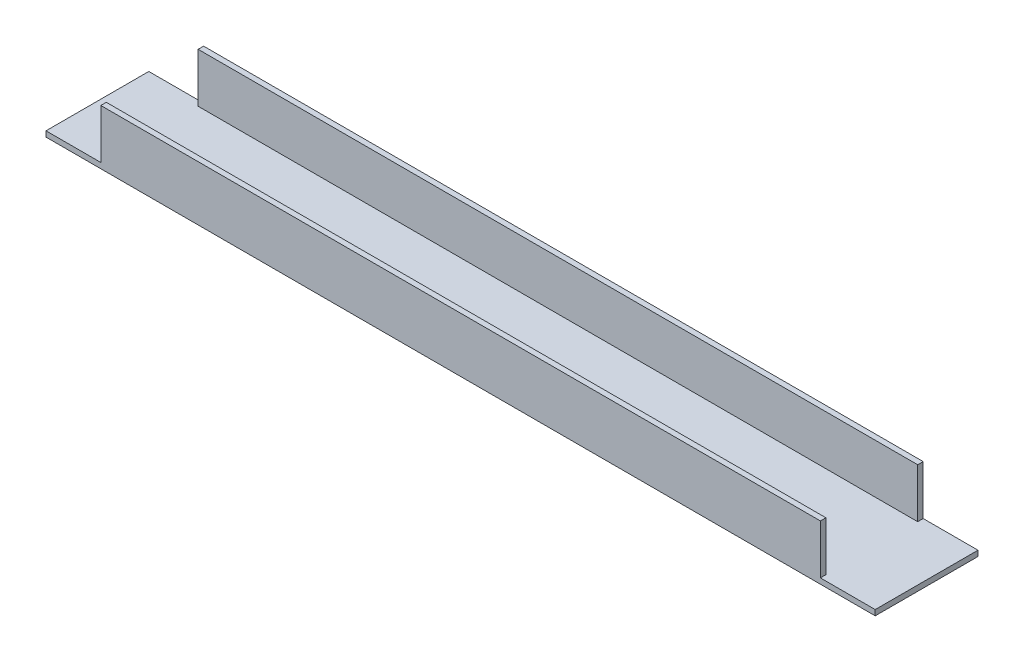
from build123d import *

# Parameters (mm, degrees)
SKETCH_2_W      = 605
SKETCH_2_H      = 75
EXTRUDE_1_DEPTH = 4
EXTRUDE_START   = -4
SKETCH_3_W      = 525
SKETCH_3_H      = 4
EXTRUDE_2_DEPTH = 40


with BuildPart() as part:
    # 스케치2 → 보스-돌출1 (new body)
    with BuildSketch(Plane(origin=(0, 0, 0), x_dir=(1, 0, 0), z_dir=(0, 1, 0))):
        with Locations((302.5, 37.5)):
            Rectangle(SKETCH_2_W, SKETCH_2_H)
    extrude(amount=EXTRUDE_1_DEPTH)

    # 스케치3 → 보스-돌출2 (add)
    with BuildSketch(Plane(origin=(0, 4, 0), x_dir=(1, 0, 0), z_dir=(0, 1, 0)).offset(EXTRUDE_START)):
        with Locations((302.5, 2)):
            Rectangle(SKETCH_3_W, SKETCH_3_H)
        with Locations((302.5, 73)):
            Rectangle(SKETCH_3_W, SKETCH_3_H)
    extrude(amount=EXTRUDE_2_DEPTH)


solid = part.part
